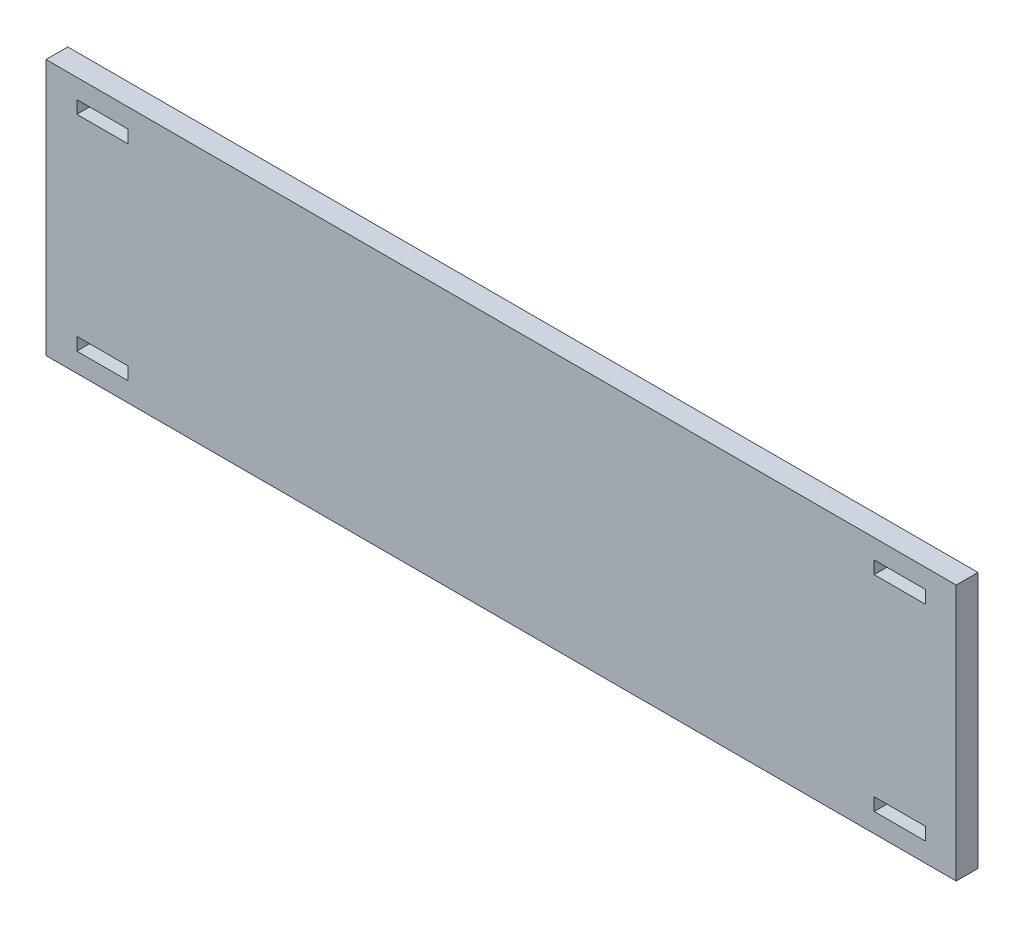
from build123d import *

# Parameters (mm, degrees)
CROQUIS2_W              = 355
CROQUIS2_H              = 100
SALIENTE_EXTRUIR1_DEPTH = 8.5
CROQUIS4_W              = 20
CROQUIS4_H              = 5
CORTAR_EXTRUIR1_DEPTH   = 6.5


with BuildPart() as part:
    # Croquis2 → Saliente-Extruir1 (new body)
    with BuildSketch(Plane.XY):
        Rectangle(CROQUIS2_W, CROQUIS2_H)
    extrude(amount=SALIENTE_EXTRUIR1_DEPTH)

    # Croquis4 → Cortar-Extruir1 (cut)
    with BuildSketch(Plane.XY.offset(8.5)):
        with Locations((-155.5, 40)):
            Rectangle(CROQUIS4_W, CROQUIS4_H)
        with Locations((-155.5, -40)):
            Rectangle(CROQUIS4_W, CROQUIS4_H)
        with Locations((155.5, 40)):
            Rectangle(CROQUIS4_W, CROQUIS4_H)
        with Locations((155.5, -40)):
            Rectangle(CROQUIS4_W, CROQUIS4_H)
    extrude(amount=-CORTAR_EXTRUIR1_DEPTH, mode=Mode.SUBTRACT)


solid = part.part
